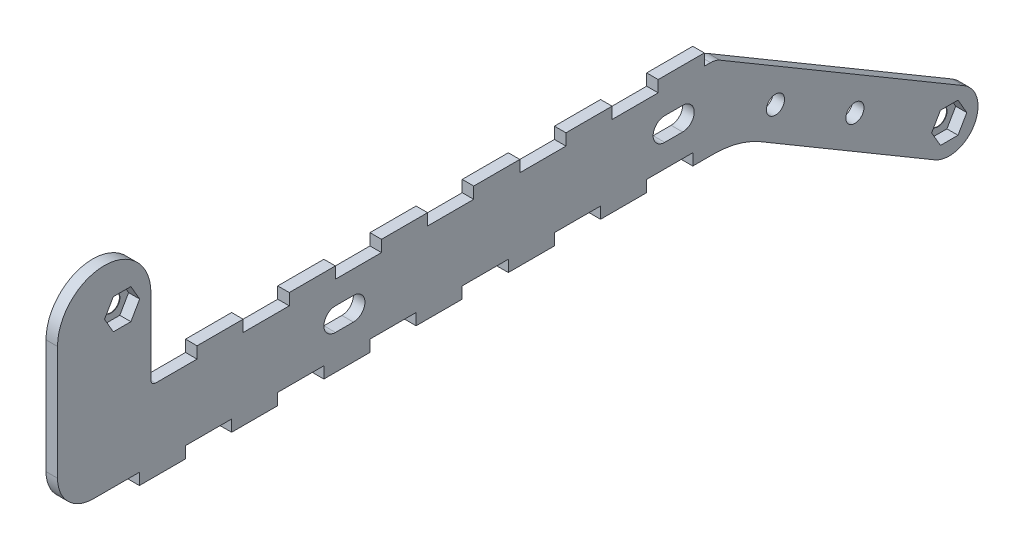
from build123d import *

# Parameters (mm, degrees)
SKETCH1_R           = 2.4384
BOSS_EXTRUDE1_DEPTH = 3.175
CUT_EXTRUDE1_START  = -3.048
SKETCH2_R           = 2.4384
CUT_EXTRUDE1_DEPTH  = 3.048
CUT_EXTRUDE2_START  = -3.048
SKETCH3_R           = 2.4384
CUT_EXTRUDE2_DEPTH  = 3.048
SKETCH7_R           = 2.5019
CUT_EXTRUDE6_DEPTH  = 249.108397571
CUT_EXTRUDE7_DEPTH  = 3.175
FILLET1_R           = 25.4
FILLET2_R           = 1.27
FILLET5_R           = 5.08


with BuildPart() as part:
    # Sketch1 → Boss-Extrude1 (new body)
    with BuildSketch(Plane(origin=(0, 0, 0), x_dir=(0, 0, -1), z_dir=(1, 0, 0))):
        with BuildLine():
            ThreePointArc((223.742915845, -76.264038282), (234.613620352, -73.464824815), (231.814406885, -62.594120308))
            Line((231.814406885, -62.594120308), (163.445060929, -22.225))
            Line((163.445060929, -22.225), (160.3375, -22.225))
            Line((160.3375, -22.225), (160.3375, -19.05))
            Line((160.3375, -19.05), (147.6375, -19.05))
            Line((147.6375, -19.05), (147.6375, -22.225))
            Line((147.6375, -22.225), (134.9375, -22.225))
            Line((134.9375, -22.225), (134.9375, -19.05))
            Line((134.9375, -19.05), (122.2375, -19.05))
            Line((122.2375, -19.05), (122.2375, -22.225))
            Line((122.2375, -22.225), (109.5375, -22.225))
            Line((109.5375, -22.225), (109.5375, -19.05))
            Line((109.5375, -19.05), (96.8375, -19.05))
            Line((96.8375, -19.05), (96.8375, -22.225))
            Line((96.8375, -22.225), (84.1375, -22.225))
            Line((84.1375, -22.225), (84.1375, -19.05))
            Line((84.1375, -19.05), (71.4375, -19.05))
            Line((71.4375, -19.05), (71.4375, -22.225))
            Line((71.4375, -22.225), (58.7375, -22.225))
            Line((58.7375, -22.225), (58.7375, -19.05))
            Line((58.7375, -19.05), (46.0375, -19.05))
            Line((46.0375, -19.05), (46.0375, -22.225))
            Line((46.0375, -22.225), (33.3375, -22.225))
            Line((33.3375, -22.225), (33.3375, -19.05))
            Line((33.3375, -19.05), (20.6375, -19.05))
            Line((20.6375, -19.05), (20.6375, -22.225))
            Line((20.6375, -22.225), (7.9375, -22.225))
            Line((7.9375, -22.225), (7.9375, 0))
            ThreePointArc((7.9375, 0), (-4.92125, 12.85875), (-17.78, 0))
            Line((-17.78, 0), (-17.78, -31.4325))
            ThreePointArc((-17.78, -31.4325), (-14.897198494, -38.392198494), (-7.9375, -41.275))
            Line((-7.9375, -41.275), (4.7625, -41.275))
            Line((4.7625, -41.275), (4.7625, -44.45))
            Line((4.7625, -44.45), (17.4625, -44.45))
            Line((17.4625, -44.45), (17.4625, -41.275))
            Line((17.4625, -41.275), (30.1625, -41.275))
            Line((30.1625, -41.275), (30.1625, -44.45))
            Line((30.1625, -44.45), (42.8625, -44.45))
            Line((42.8625, -44.45), (42.8625, -41.275))
            Line((42.8625, -41.275), (55.5625, -41.275))
            Line((55.5625, -41.275), (55.5625, -44.45))
            Line((55.5625, -44.45), (68.2625, -44.45))
            Line((68.2625, -44.45), (68.2625, -41.275))
            Line((68.2625, -41.275), (80.9625, -41.275))
            Line((80.9625, -41.275), (80.9625, -44.45))
            Line((80.9625, -44.45), (93.6625, -44.45))
            Line((93.6625, -44.45), (93.6625, -41.275))
            Line((93.6625, -41.275), (106.3625, -41.275))
            Line((106.3625, -41.275), (106.3625, -44.45))
            Line((106.3625, -44.45), (119.0625, -44.45))
            Line((119.0625, -44.45), (119.0625, -41.275))
            Line((119.0625, -41.275), (131.7625, -41.275))
            Line((131.7625, -41.275), (131.7625, -44.45))
            Line((131.7625, -44.45), (144.4625, -44.45))
            Line((144.4625, -44.45), (144.4625, -41.275))
            Line((144.4625, -41.275), (157.1625, -41.275))
            Line((157.1625, -41.275), (157.1625, -44.45))
            Line((157.1625, -44.45), (169.8625, -44.45))
            Line((169.8625, -44.45), (223.742915845, -76.264038282))
        make_face()
        with Locations((227.778661365, -69.429079295)):
            Circle(SKETCH1_R, mode=Mode.SUBTRACT)
        Circle(SKETCH1_R, mode=Mode.SUBTRACT)
    extrude(amount=BOSS_EXTRUDE1_DEPTH)

    # Sketch2 → Cut-Extrude1 (cut)
    with BuildSketch(Plane(origin=(3.175, 0, 0), x_dir=(0, 0, -1), z_dir=(1, 0, 0)).offset(CUT_EXTRUDE1_START)):
        Polygon((2.419674978, 4.191), (-2.419674978, 4.191), (-4.839349956, 0), (-2.419674978, -4.191), (2.419674978, -4.191), (4.839349956, 0), align=None)
        Circle(SKETCH2_R, mode=Mode.SUBTRACT)
    extrude(amount=CUT_EXTRUDE1_DEPTH, mode=Mode.SUBTRACT)

    # Sketch3 → Cut-Extrude2 (cut)
    with BuildSketch(Plane(origin=(3.175, 0, 0), x_dir=(0, 0, -1), z_dir=(1, 0, 0)).offset(CUT_EXTRUDE2_START)):
        Polygon((230.198336343, -65.238079295), (225.358986387, -65.238079295), (222.939311409, -69.429079295), (225.358986387, -73.620079295), (230.198336343, -73.620079295), (232.618011321, -69.429079295), align=None)
        with Locations((227.778661365, -69.429079295)):
            Circle(SKETCH3_R, mode=Mode.SUBTRACT)
    extrude(amount=CUT_EXTRUDE2_DEPTH, mode=Mode.SUBTRACT)

    # Sketch7 → Cut-Extrude6 (cut, through all)
    with BuildSketch(Plane.ZY):
        with Locations((-201.805817216, -54.09324632)):
            Circle(SKETCH7_R)
        with Locations((-179.933948459, -41.178860656)):
            Circle(SKETCH7_R)
    extrude(amount=-CUT_EXTRUDE6_DEPTH, mode=Mode.SUBTRACT)

    # Sketch9 → Cut-Extrude7 (cut)
    with BuildSketch(Plane(origin=(3.175, 0, 0), x_dir=(0, 0, -1), z_dir=(1, 0, 0))):
        with BuildLine():
            Line((58.74893, -28.575), (63.69939, -28.575))
            ThreePointArc((63.69939, -28.575), (66.87439, -31.75), (63.69939, -34.925))
            Line((63.69939, -34.925), (58.74893, -34.925))
            ThreePointArc((58.74893, -34.925), (55.57393, -31.75), (58.74893, -28.575))
        make_face()
        with BuildLine():
            Line((154.37485, -28.575), (149.42439, -28.575))
            ThreePointArc((149.42439, -28.575), (146.24939, -31.75), (149.42439, -34.925))
            Line((149.42439, -34.925), (154.37485, -34.925))
            ThreePointArc((154.37485, -34.925), (157.54985, -31.75), (154.37485, -28.575))
        make_face()
    extrude(amount=-CUT_EXTRUDE7_DEPTH, mode=Mode.SUBTRACT)

    # Fillet1
    fillet1_edges = [part.edges().sort_by_distance(p)[0] for p in [
        (1.5875, -44.45, -169.8625),
    ]]
    fillet(fillet1_edges, radius=FILLET1_R)

    # Fillet2
    fillet2_edges = [part.edges().sort_by_distance(p)[0] for p in [
        (1.5875, -22.225, -7.9375),
    ]]
    fillet(fillet2_edges, radius=FILLET2_R)

    # Fillet5
    fillet5_edges = [part.edges().sort_by_distance(p)[0] for p in [
        (1.5875, -22.225, -163.445060929),
    ]]
    fillet(fillet5_edges, radius=FILLET5_R)


solid = part.part
